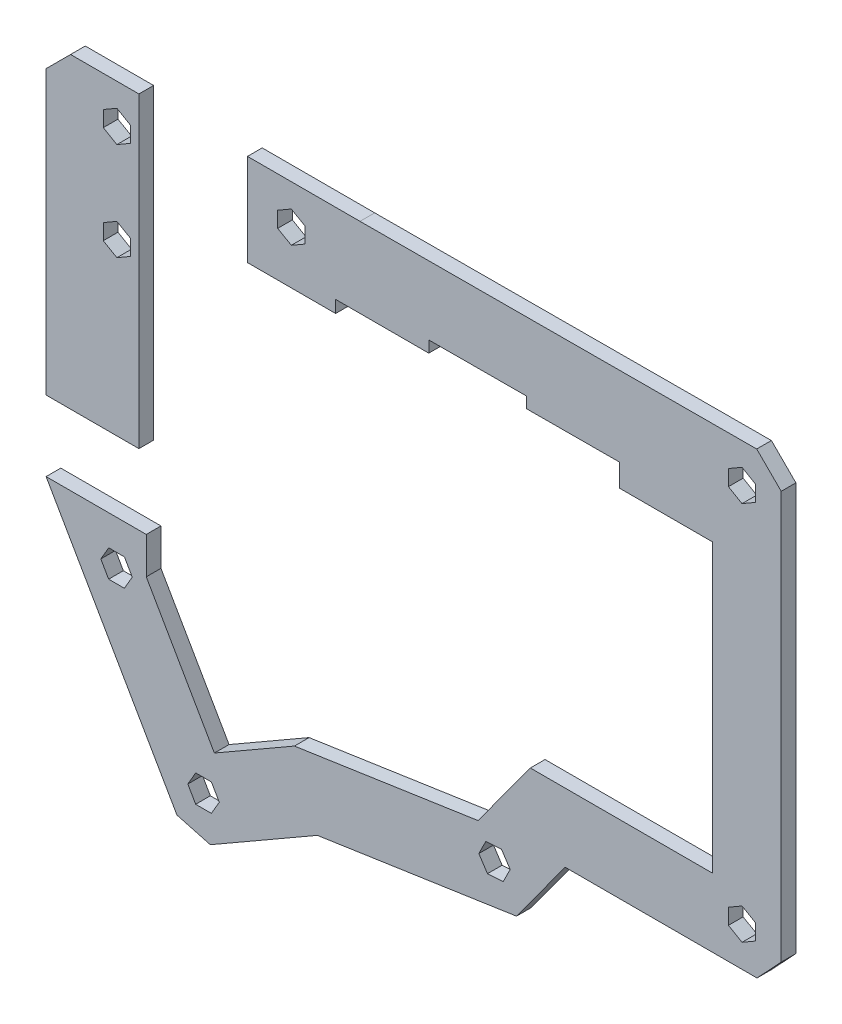
from build123d import *

# Parameters (mm, degrees)
BOSS_EXTRU_1_DEPTH   = 3
BOSS_EXTRU_1_2_DEPTH = 3


with BuildPart() as part:
    # Esquisse1 → Boss.-Extru.1 (new body)
    with BuildSketch(Plane.XY):
        Polygon((-160.478985875, -70.841138967), (-133.761270027, -117.344044002), (-126.936961278, -119.18521524), (-105.07834936, -106.603969177), (-64.409664562, -100.558603138), (-54.463628843, -86.933633781), (-15.285065671, -86.933633781), (-10.338932594, -81.648576105), (-10.338932594, 1.62478686), (-15.338909651, 6.609639935), (-96.368661727, 6.364168479), (-103.365175584, 6.364168479), (-119.345597764, 6.364168479), (-119.345597764, 1.542908687), (-119.346382005, -12.429484403), (-101.345774335, -12.429484403), (-101.345774335, -9.929307079), (-82.318329451, -9.929307079), (-82.325535908, -7.59335353), (-62.324350924, -7.532761958), (-62.31741501, -9.781019755), (-43.341802282, -9.722479661), (-43.341802282, -14.337028264), (-24.339106961, -14.337028264), (-24.339106961, -72.933633781), (-61.577157206, -72.933633781), (-72.263087593, -87.572177036), (-109.761976756, -93.1463556), (-126.111124489, -102.556497988), (-140.02282508, -78.342807898), (-140.02282508, -70.841138967), align=None)
        Polygon((-110.397084988, -4.888433419), (-107.617084988, -3.283399671), (-107.617084988, -0.073332174), (-110.397084988, 1.531701574), (-113.177084988, -0.073332174), (-113.177084988, -3.283399671), align=None, mode=Mode.SUBTRACT)
        Polygon((-18.339106961, -4.551994484), (-15.559106961, -2.946960735), (-15.559106961, 0.263106761), (-18.339106961, 1.86814051), (-21.119106961, 0.263106761), (-21.119106961, -2.946960735), align=None, mode=Mode.SUBTRACT)
        Polygon((-18.339106961, -75.723566285), (-21.119106961, -77.328600033), (-21.119106961, -80.53866753), (-18.339106961, -82.143701278), (-15.559106961, -80.53866753), (-15.559106961, -77.328600033), align=None, mode=Mode.SUBTRACT)
        Polygon((-70.666109178, -90.458987975), (-72.101631087, -93.330191587), (-70.332856775, -96.008991835), (-67.128560553, -95.81658847), (-65.693038643, -92.945384858), (-67.461812956, -90.266584611), align=None, mode=Mode.SUBTRACT)
        Polygon((-129.921410961, -107.968661897), (-131.53231051, -110.745267014), (-129.933149717, -113.528649505), (-126.723089375, -113.535426879), (-125.112189826, -110.758821762), (-126.711350619, -107.975439271), align=None, mode=Mode.SUBTRACT)
        Polygon((-144.493218107, -82.606038544), (-142.882318558, -79.829433427), (-144.481479351, -77.046050936), (-147.691539693, -77.039273562), (-149.302439242, -79.815878679), (-147.703278449, -82.59926117), align=None, mode=Mode.SUBTRACT)
    extrude(amount=BOSS_EXTRU_1_DEPTH)


with BuildPart() as body_2:
    # Esquisse1 → Boss.-Extru.1 2 (new body)
    with BuildSketch(Plane.XY):
        Polygon((-160.478985875, -3.429484403), (-160.478985875, -56.420747812), (-141.52282508, -56.420747812), (-141.52282508, 1.570515597), (-141.52282508, 6.320852512), (-155.478985875, 6.320852512), (-160.478985875, 1.320852512), align=None)
        Polygon((-146.02282508, -18.467800689), (-148.80282508, -20.072834437), (-148.80282508, -23.282901934), (-146.02282508, -24.887935682), (-143.24282508, -23.282901934), (-143.24282508, -20.072834437), align=None, mode=Mode.SUBTRACT)
        Polygon((-146.02282508, -4.887935682), (-143.24282508, -3.282901934), (-143.24282508, -0.072834437), (-146.02282508, 1.532199311), (-148.80282508, -0.072834437), (-148.80282508, -3.282901934), align=None, mode=Mode.SUBTRACT)
    extrude(amount=BOSS_EXTRU_1_2_DEPTH)


solid = Compound([part.part, body_2.part])
